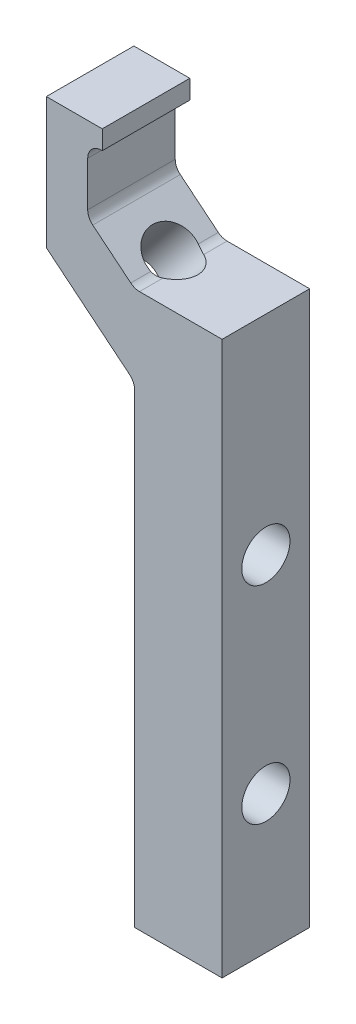
from build123d import *

# Parameters (mm, degrees)
BOSS_EXTRUDE1_DEPTH     = 12.7
CUT_EXTRUDE1_DEPTH      = 100.645019946
CUT_EXTRUDE1_DEPTH_BACK = 100.645019946
SKETCH6_R               = 3.5
SKETCH8_R               = 3.5
CUT_EXTRUDE2_DEPTH      = 315.511656717


with BuildPart() as part:
    # Sketch1 → Boss-Extrude1 (new body)
    with BuildSketch(Plane.XY):
        with BuildLine():
            Line((-312.7, 0), (-300, 0))
            Line((-300, 0), (-300, 80.249402298))
            Line((-300, 80.249402298), (-311.985474591, 80.249402298))
            ThreePointArc((-311.985474591, 80.249402298), (-312.658347569, 80.365989981), (-313.252771846, 80.702160342))
            Line((-313.252771846, 80.702160342), (-317.170141731, 83.91075489))
            Line((-317.170141731, 83.91075489), (-318.5, 85))
            Line((-318.5, 85), (-318.767297255, 85.21893478))
            ThreePointArc((-318.767297255, 85.21893478), (-319.307566667, 85.91019616), (-319.5, 86.766176735))
            Line((-319.5, 86.766176735), (-319.5, 93.25))
            ThreePointArc((-319.5, 93.25), (-318.914213562, 94.664213562), (-317.5, 95.25))
            Line((-317.5, 95.25), (-317.388555411, 95.25))
            Line((-317.388555411, 95.25), (-317.388555411, 96.25))
            Line((-317.388555411, 96.25), (-317.388555411, 98))
            Line((-317.388555411, 98), (-318.5, 98))
            Line((-318.5, 98), (-325.5, 98))
            Line((-325.5, 98), (-325.5, 85))
            Line((-325.5, 85), (-325.5, 82))
            Line((-325.5, 82), (-325.5, 79))
            Line((-325.5, 79), (-313.432702745, 69.116056102))
            ThreePointArc((-313.432702745, 69.116056102), (-312.892433333, 68.424794722), (-312.7, 67.568814146))
            Line((-312.7, 67.568814146), (-312.7, 63.3))
            Line((-312.7, 63.3), (-312.7, 60.3))
            Line((-312.7, 60.3), (-312.7, 0))
        make_face()
    extrude(amount=BOSS_EXTRUDE1_DEPTH)

    # Sketch6 → Cut-Extrude1 (cut, two sides: drawn at the far end of the back side and taken through both)
    with BuildSketch(Plane.ZY.offset(312.7).offset(-CUT_EXTRUDE1_DEPTH_BACK)):
        with Locations((6.35, 50)):
            Circle(SKETCH6_R)
        with Locations((6.35, 20)):
            Circle(SKETCH6_R)
    extrude(amount=CUT_EXTRUDE1_DEPTH + CUT_EXTRUDE1_DEPTH_BACK, mode=Mode.SUBTRACT)

    # Sketch8 → Cut-Extrude2 (cut, through all)
    with BuildSketch(Plane(origin=(-91.96558898, -112.280695929, 0), x_dir=(0.7736209776319443, -0.6336486273699289, 0), z_dir=(-0.6336486273699289, -0.7736209776319443, 0))):
        with Locations((-294.07263889, 6.35)):
            Circle(SKETCH8_R)
    extrude(amount=-CUT_EXTRUDE2_DEPTH, mode=Mode.SUBTRACT)


solid = part.part
